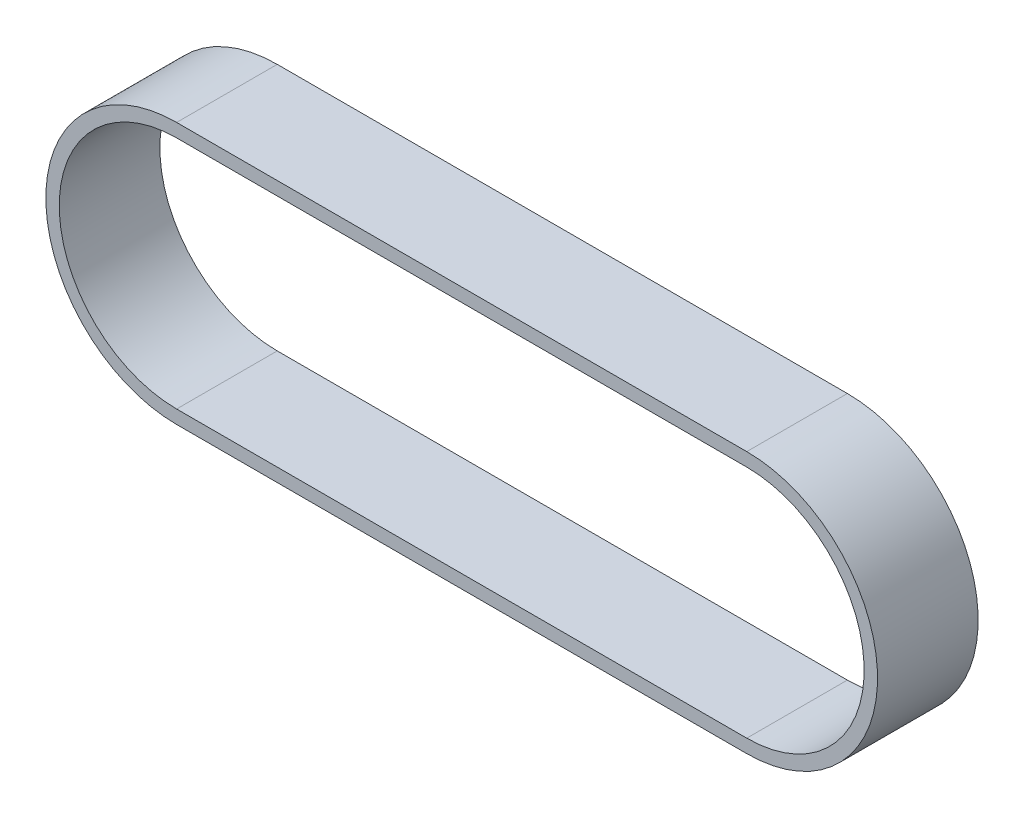
from build123d import *

# Parameters (mm, degrees)
BOSS_EXTRUDE1_DEPTH      = 7.5
BOSS_EXTRUDE1_DEPTH_BACK = 7.5


with BuildPart() as part:
    # Sketch1 → Boss-Extrude1 (new, two sides: drawn at the far end of the back side and taken through both)
    with BuildSketch(Plane.XY.offset(-BOSS_EXTRUDE1_DEPTH_BACK)):
        with BuildLine():
            Line((-42.5, 19.5), (42.5, 19.5))
            ThreePointArc((42.5, 19.5), (62, 0), (42.5, -19.5))
            Line((42.5, -19.5), (-42.5, -19.5))
            ThreePointArc((-42.5, -19.5), (-62, 0), (-42.5, 19.5))
        make_face()
        with BuildLine():
            Line((-42.5, 17.5), (42.5, 17.5))
            ThreePointArc((42.5, 17.5), (60, 0), (42.5, -17.5))
            Line((42.5, -17.5), (-42.5, -17.5))
            ThreePointArc((-42.5, -17.5), (-60, 0), (-42.5, 17.5))
        make_face(mode=Mode.SUBTRACT)
    extrude(amount=BOSS_EXTRUDE1_DEPTH + BOSS_EXTRUDE1_DEPTH_BACK)


solid = part.part
